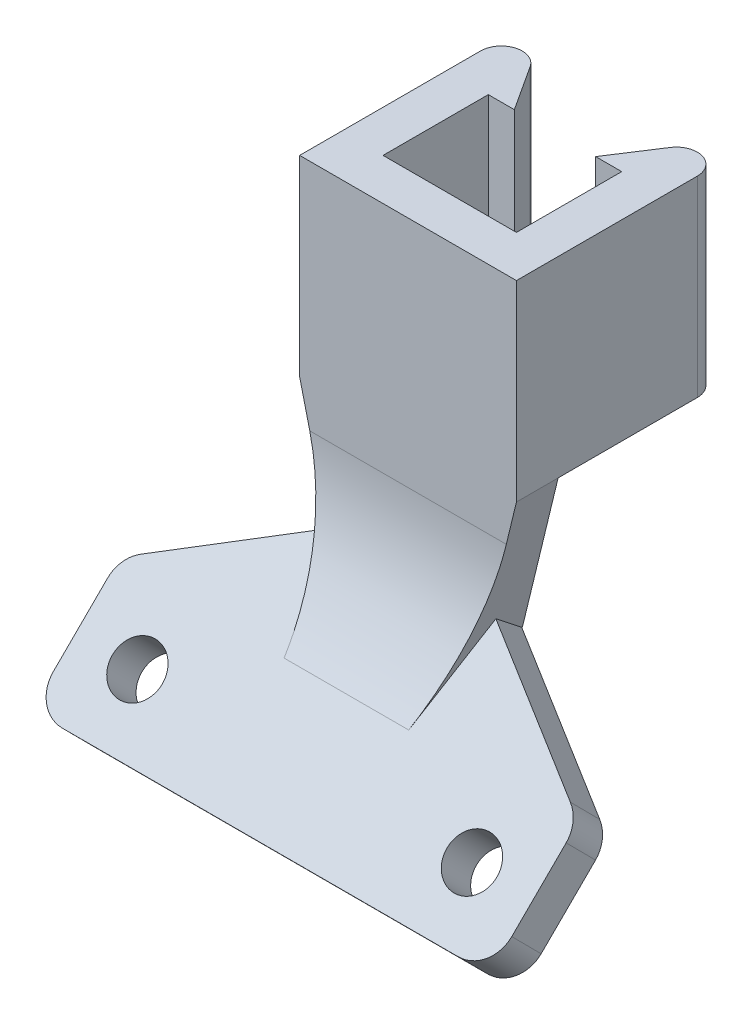
from build123d import *

# Parameters (mm, degrees)
SKETCH2_W           = 8.999610642
SKETCH2_H           = 9.2
BOSS_EXTRUDE1_DEPTH = 2
BOSS_EXTRUDE2_START = 6.4
SKETCH3_W           = 8.999610642
SKETCH3_H           = 9.2
BOSS_EXTRUDE2_DEPTH = 2
SKETCH4_W           = 1.999805321
SKETCH4_H           = 9.2
BOSS_EXTRUDE3_DEPTH = 7
CUT_EXTRUDE2_DEPTH  = 9.2
BOSS_EXTRUDE4_DEPTH = 9.2
FILLET1_R           = 1
BOSS_EXTRUDE6_DEPTH = 1.999805321
SKETCH11_R          = 1.2
BOSS_EXTRUDE7_DEPTH = 2
FILLET2_R           = 10
SKETCH13_W          = 7
SKETCH13_H          = 0.042993575
BOSS_EXTRUDE8_DEPTH = 1


with BuildPart() as part:
    # Sketch2 → Boss-Extrude1 (new body)
    with BuildSketch(Plane(origin=(0, 0, 0), x_dir=(0, 0, -1), z_dir=(1, 0, 0))):
        Rectangle(SKETCH2_W, SKETCH2_H)
    extrude(amount=BOSS_EXTRUDE1_DEPTH)



with BuildPart() as body_2:
    # Sketch3 → Boss-Extrude2 (new body)
    with BuildSketch(Plane.ZY.offset(BOSS_EXTRUDE2_START)):
        Rectangle(SKETCH3_W, SKETCH3_H)
    extrude(amount=BOSS_EXTRUDE2_DEPTH)


with BuildPart() as part_1:
    add(part.part)

    add(body_2.part)  # Boss-Extrude3 merges body 2
    # Sketch4 → Boss-Extrude3 (add)
    with BuildSketch(Plane.ZY):
        with Locations((3.499902661, 0)):
            Rectangle(SKETCH4_W, SKETCH4_H)
    extrude(amount=BOSS_EXTRUDE3_DEPTH)

    # Sketch5 → Cut-Extrude2 (cut)
    with BuildSketch(Plane(origin=(0, 4.6, 0), x_dir=(1, 0, 0), z_dir=(0, 1, 0))):
        Polygon((-5.15, 2.55), (-1.25, 2.55), (0, 4.473076923), (0, 4.499805321), (0.017373458, 4.499805321), (2, 7.55), (-8.4, 7.55), (-6.417373458, 4.499805321), (-6.4, 4.499805321), (-6.4, 4.473076923), align=None)
        Polygon((0, 4.499805321), (0, 4.473076923), (0.017373458, 4.499805321), align=None)
        Polygon((-6.417373458, 4.499805321), (-6.4, 4.473076923), (-6.4, 4.499805321), align=None)
    extrude(amount=-CUT_EXTRUDE2_DEPTH, mode=Mode.SUBTRACT)

    # Sketch5<3> → Boss-Extrude4 (add)
    with BuildSketch(Plane(origin=(0, 4.6, 0), x_dir=(1, 0, 0), z_dir=(0, 1, 0))):
        Polygon((-6.4, 2.55), (-5.15, 2.55), (-6.4, 4.473076923), align=None)
        Polygon((-8.4, 4.499805321), (-6.417373458, 4.499805321), (-8.4, 7.55), align=None)
        Polygon((-1.25, 2.55), (0, 2.55), (0, 4.473076923), align=None)
        Polygon((0.017373458, 4.499805321), (2, 4.499805321), (2, 7.55), align=None)
    extrude(amount=-BOSS_EXTRUDE4_DEPTH)

    # Fillet1
    fillet1_edges = [part_1.edges().sort_by_distance(p)[0] for p in [
        (-8.4, 0, -7.55),
        (2, 0, -7.55),
    ]]
    fillet(fillet1_edges, radius=FILLET1_R)

    # Sketch9 → Boss-Extrude6 (add)
    with BuildSketch(Plane.XY.offset(4.499805321)):
        Polygon((-6.7, -11.6), (0.3, -11.6), (2, -4.6), (-8.4, -4.6), align=None)
    extrude(amount=-BOSS_EXTRUDE6_DEPTH)

    # Sketch11 → Boss-Extrude7 (add)
    with BuildSketch(Plane(origin=(0, -4.596209487, -4.559766639), x_dir=(1, 0, 0), z_dir=(0, 0.7099156022207138, 0.7042867581628958))):
        with BuildLine():
            Line((7.8, -19.262920267), (7.8, -15.587764453))
            ThreePointArc((7.8, -15.587764453), (7.614381512, -14.864991154), (7.103465011, -14.321097971))
            Line((7.103465011, -14.321097971), (0.3, -10.005560954))
            Line((0.3, -10.005560954), (-6.7, -10.005560954))
            Line((-6.7, -10.005560954), (-13.503465011, -14.321097971))
            ThreePointArc((-13.503465011, -14.321097971), (-14.014381512, -14.864991154), (-14.2, -15.587764453))
            Line((-14.2, -15.587764453), (-14.2, -19.262920267))
            ThreePointArc((-14.2, -19.262920267), (-13.760660172, -20.323580438), (-12.7, -20.762920267))
            Line((-12.7, -20.762920267), (6.3, -20.762920267))
            ThreePointArc((6.3, -20.762920267), (7.360660172, -20.323580438), (7.8, -19.262920267))
        make_face()
        with Locations(Location((4.825, -17.762920267, 0), (0, 0, 270))):
            Circle(SKETCH11_R, mode=Mode.SUBTRACT)
        with Locations(Location((-11.225, -17.762920267, 0), (0, 0, 270))):
            Circle(SKETCH11_R, mode=Mode.SUBTRACT)
    extrude(amount=BOSS_EXTRUDE7_DEPTH)

    # Fillet2
    fillet2_edges = [part_1.edges().sort_by_distance(p)[0] for p in [
        (-3.2, -10.766712787, 4.499805321),
    ]]
    fillet(fillet2_edges, radius=FILLET2_R)

    # Sketch13 → Boss-Extrude8 (add)
    with BuildSketch(Plane(origin=(0, 0, 2.5), x_dir=(-1, 0, 0), z_dir=(0, 0, -1))):
        with Locations((3.2, -11.621496787)):
            Rectangle(SKETCH13_W, SKETCH13_H)
    extrude(amount=-BOSS_EXTRUDE8_DEPTH)


solid = part_1.part
